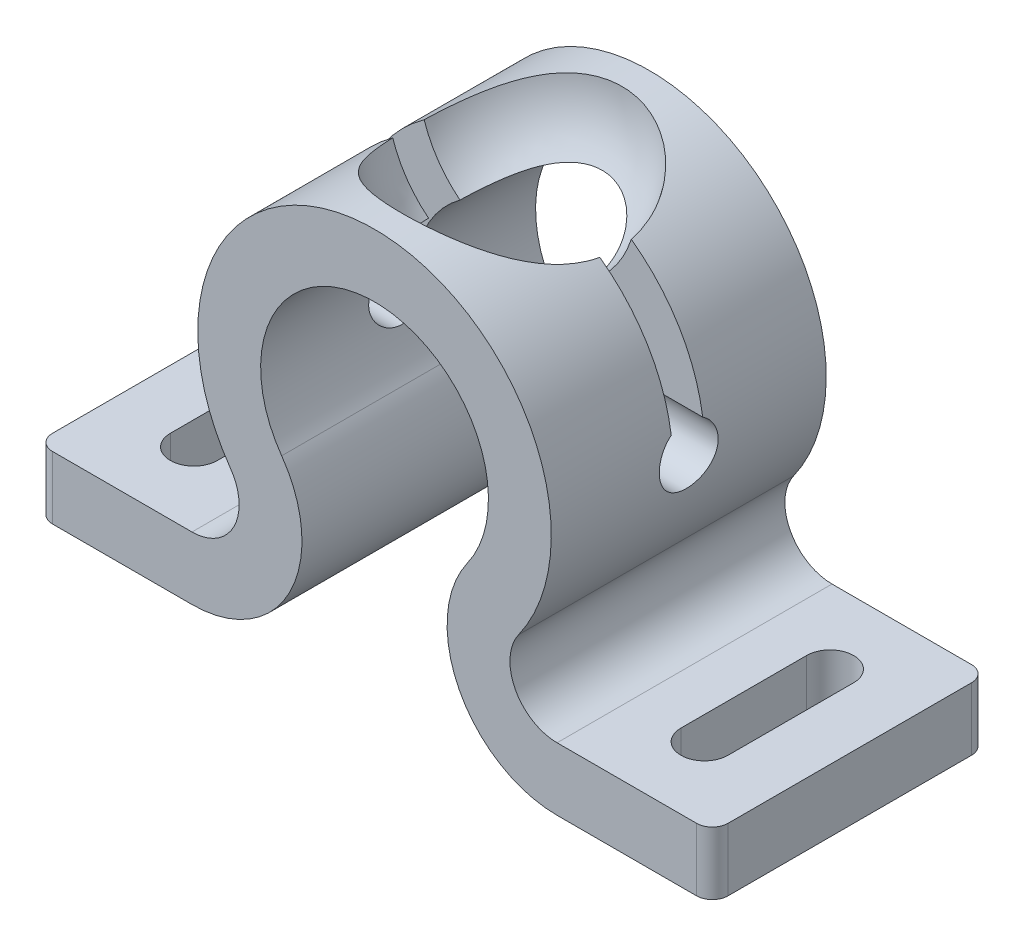
from build123d import *

# Parameters (mm, degrees)
EXTRUDE_THIN1_DEPTH = 70
CUT_EXTRUDE1_DEPTH  = 214.822356174
CUT_EXTRUDE2_DEPTH  = 143.814565196
FILLET1_R           = 4


with BuildPart() as part:
    # Sketch1 → Extrude-Thin1 (new body)
    with BuildSketch(Plane.XY):
        with BuildLine():
            Line((-86, 0), (-46.475800154, 0))
            ThreePointArc((-46.475800154, 0), (-21.597147289, 15.152718903), (-23.645582535, 44.210526316))
            ThreePointArc((-23.645582535, 44.210526316), (0, 90), (23.645582535, 44.210526316))
            ThreePointArc((23.645582535, 44.210526316), (21.597147289, 15.152718903), (46.475800154, 0))
            Line((46.475800154, 0), (86, 0))
            Line((86, 0), (86, 16))
            Line((86, 16), (46.475800154, 16))
            ThreePointArc((46.475800154, 16), (35.813520355, 22.494022387), (36.691421175, 34.947368421))
            ThreePointArc((36.691421175, 34.947368421), (0, 106), (-36.691421175, 34.947368421))
            ThreePointArc((-36.691421175, 34.947368421), (-35.813520355, 22.494022387), (-46.475800154, 16))
            Line((-46.475800154, 16), (-86, 16))
            Line((-86, 16), (-86, 0))
        make_face()
    extrude(amount=EXTRUDE_THIN1_DEPTH)

    # Sketch3 → Cut-Extrude1 (cut, through all)
    with BuildSketch(Plane(origin=(86, 0, 0), x_dir=(0, 0, -1), z_dir=(1, 0, 0))):
        with BuildLine():
            Line((-39, 67.34428877), (-39, 116))
            Line((-39, 116), (-31, 116))
            Line((-31, 116), (-31, 67.34428877))
            ThreePointArc((-31, 67.34428877), (-35, 53.5), (-39, 67.34428877))
        make_face()
    extrude(amount=-CUT_EXTRUDE1_DEPTH, mode=Mode.SUBTRACT)

    # Sketch4 → Cut-Extrude2 (cut, through all)
    with BuildSketch(Plane(origin=(0, 16, 0), x_dir=(1, 0, 0), z_dir=(0, 1, 0))):
        with BuildLine():
            Line((-59, -19), (-59, -51))
            ThreePointArc((-59, -51), (-65, -57), (-71, -51))
            Line((-71, -51), (-71, -19))
            ThreePointArc((-71, -19), (-65, -13), (-59, -19))
        make_face()
        with BuildLine():
            Line((71, -19), (71, -51))
            ThreePointArc((71, -51), (65, -57), (59, -51))
            Line((59, -51), (59, -19))
            ThreePointArc((59, -19), (65, -13), (71, -19))
        make_face()
    extrude(amount=-CUT_EXTRUDE2_DEPTH, mode=Mode.SUBTRACT)

    # Sketch6 → Cut-Revolve1 (revolve, cut)
    with BuildSketch(Plane.XY.offset(35)):
        with BuildLine():
            Line((0, 134), (0, 78))
            ThreePointArc((0, 78), (-28, 106), (0, 134))
        make_face()
    revolve(axis=Axis((0, 134, 35), (0, -1, 0)), mode=Mode.SUBTRACT)

    # Fillet1
    fillet1_edges = [part.edges().sort_by_distance(p)[0] for p in [
        (-86, 8, 0),
        (86, 8, 0),
        (-86, 8, 70),
        (86, 8, 70),
    ]]
    fillet(fillet1_edges, radius=FILLET1_R)


solid = part.part
